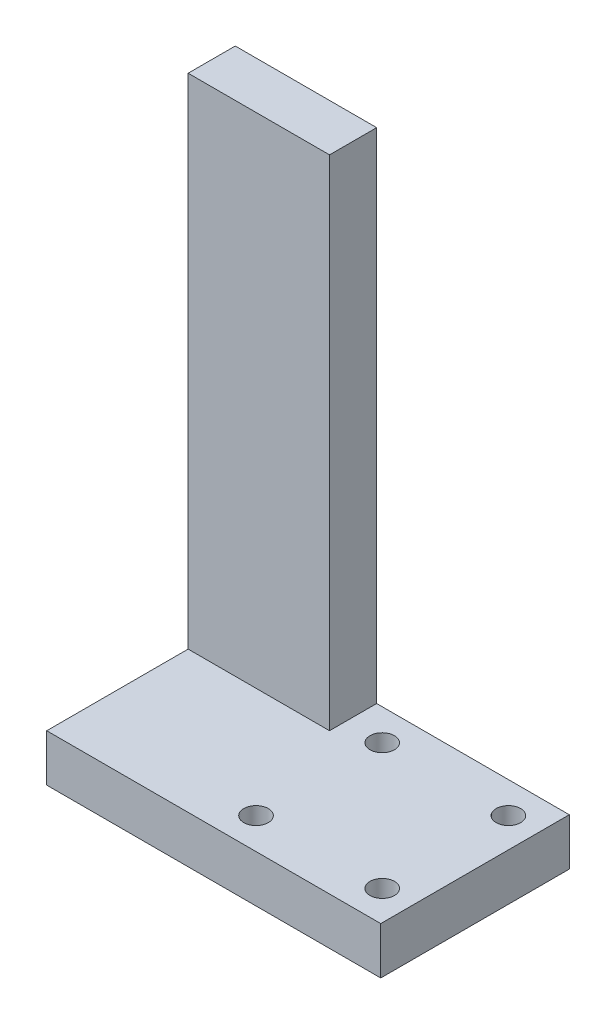
from build123d import *

# Parameters (mm, degrees)
CROQUIS1_W                   = 90
CROQUIS1_H                   = 50.8
SALIENTE_EXTRUIR1_DEPTH      = 6.35
TALADRO_DE_MARGEN_PARA_M61_D = 6.6
CROQUIS4_W                   = 38.1
CROQUIS4_H                   = 12.7
SALIENTE_EXTRUIR2_DEPTH      = 134.38


with BuildPart() as part:
    # Croquis1 → Saliente-Extruir1 (new, symmetric)
    with BuildSketch(Plane(origin=(0, 0, 0), x_dir=(1, 0, 0), z_dir=(0, 1, 0))):
        Rectangle(CROQUIS1_W, CROQUIS1_H)
    extrude(amount=SALIENTE_EXTRUIR1_DEPTH, both=True)

    # Taladro de margen para M61 (through all)
    with Locations(Plane(origin=(0, -6.35, 0), x_dir=(-1, 0, 0), z_dir=(0, -1, 0))):
        with Locations((-36.583684882, -75.725395139), (-37, -17), (-37, 17), (-3, -17), (-3, 17)):
            Hole(TALADRO_DE_MARGEN_PARA_M61_D / 2)

    # Croquis4 → Saliente-Extruir2 (add)
    with BuildSketch(Plane(origin=(0, 6.35, 0), x_dir=(1, 0, 0), z_dir=(0, 1, 0))):
        with Locations((-25.95, 19.05)):
            Rectangle(CROQUIS4_W, CROQUIS4_H)
    extrude(amount=SALIENTE_EXTRUIR2_DEPTH)


solid = part.part
